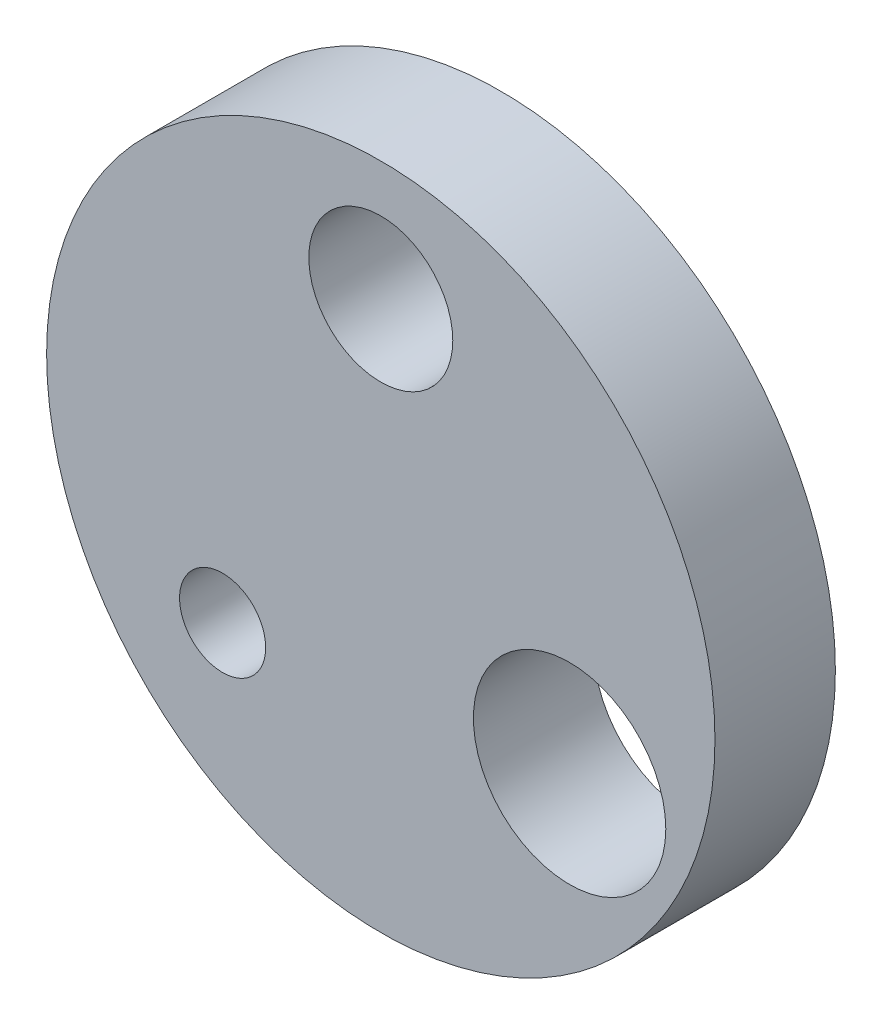
from build123d import *

# Parameters (mm, degrees)
CROQUIS1_R              = 55.5
CROQUIS1_R_2            = 11.955271639
CROQUIS1_R_3            = 7.149784922
CROQUIS1_R_4            = 15.975982674
SALIENTE_EXTRUIR1_DEPTH = 20


with BuildPart() as part:
    # Croquis1 → Saliente-Extruir1 (new body)
    with BuildSketch(Plane.XY):
        Circle(CROQUIS1_R)
        with Locations((0, 35.635905847)):
            Circle(CROQUIS1_R_2, mode=Mode.SUBTRACT)
        with Locations((-26.268821142, -24.080424027)):
            Circle(CROQUIS1_R_3, mode=Mode.SUBTRACT)
        with Locations((31.357156201, -16.930639105)):
            Circle(CROQUIS1_R_4, mode=Mode.SUBTRACT)
    extrude(amount=SALIENTE_EXTRUIR1_DEPTH)


solid = part.part
